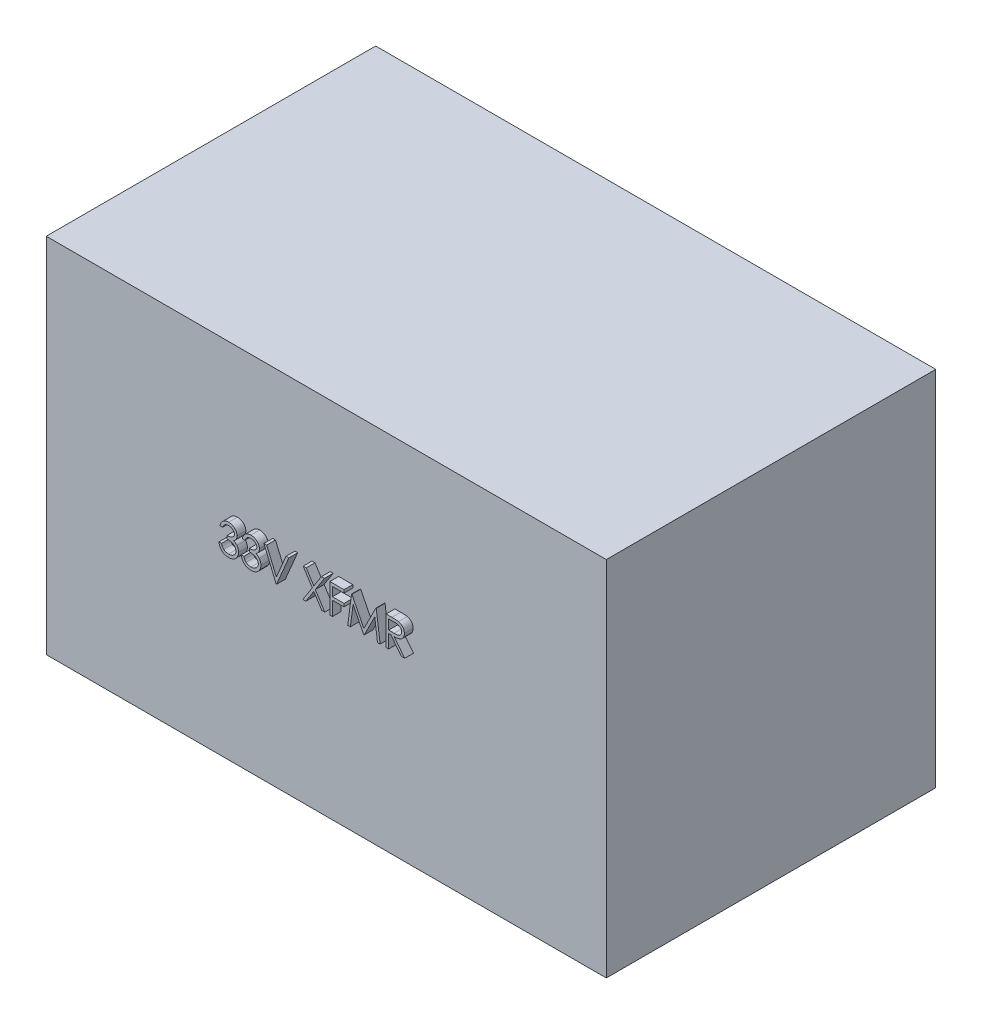
from build123d import *

# Parameters (mm, degrees)
SKETCH1_W           = 102
SKETCH1_H           = 60
BOSS_EXTRUDE1_DEPTH = 66
BOSS_EXTRUDE2_DEPTH = 1.6


with BuildPart() as part:
    # Sketch1 → Boss-Extrude1 (new body)
    with BuildSketch(Plane(origin=(0, 0, 0), x_dir=(1, 0, 0), z_dir=(0, 1, 0))):
        Rectangle(SKETCH1_W, SKETCH1_H)
    extrude(amount=BOSS_EXTRUDE1_DEPTH)

    # Sketch2 → Boss-Extrude2 (add)
    # profile 1 of 7: a face of its own
    with BuildSketch(Plane.XY.offset(30)):
        with BuildLine():
            Line((-17.291654312, 37.742865683), (-17.766547475, 37.742865683))
            add(Edge.make_bspline(
                [(-17.766547475, 37.742865683), (-17.753681845, 37.796133843), (-17.72853059, 37.90026874), (-17.676071163, 38.049051146), (-17.618922289, 38.189845041), (-17.550298286, 38.320014105), (-17.475445765, 38.442174351), (-17.389686412, 38.553555051), (-17.296976831, 38.656988939), (-17.194431968, 38.748781572), (-17.086892205, 38.831902663), (-16.972842245, 38.902773285), (-16.854576679, 38.963739564), (-16.731276109, 39.013965391), (-16.602573445, 39.051801599), (-16.469632229, 39.07925296), (-16.33210408, 39.097080002), (-16.238747603, 39.098819846), (-16.191343816, 39.09970329)],
                knots=[0, 0, 0, 0, 1.162005537, 2.271625781, 3.343758855, 4.383309926, 5.390229558, 6.379919256, 7.361854164, 8.333198761, 9.295911338, 10.242430842, 11.177959212, 12.116337295, 13.062827104, 14.020064771, 14.994644689, 16, 16, 16, 16], degree=3))
            add(Edge.make_bspline(
                [(-16.191343816, 39.09970329), (-16.12227586, 39.097618025), (-15.985646522, 39.093492981), (-15.784921439, 39.055824726), (-15.591357082, 38.996217681), (-15.407072148, 38.913858593), (-15.23589666, 38.812277775), (-15.08359314, 38.691378708), (-14.952225987, 38.55349405), (-14.84201663, 38.401196006), (-14.755724667, 38.238431129), (-14.692094079, 38.070911844), (-14.653356537, 37.89903553), (-14.648336172, 37.782985834), (-14.645820979, 37.724845184)],
                knots=[0, 0, 0, 0, 1.083050992, 2.142477498, 3.193116406, 4.255571735, 5.30263384, 6.308962982, 7.297363603, 8.282367274, 9.249857812, 10.179914175, 11.08814088, 12, 12, 12, 12], degree=3))
            add(Edge.make_bspline(
                [(-14.645820979, 37.724845184), (-14.647580218, 37.668894434), (-14.651022775, 37.559407501), (-14.680253497, 37.399566666), (-14.729445228, 37.248918056), (-14.797586416, 37.106827489), (-14.885793284, 36.974195886), (-14.992643671, 36.850724837), (-15.118891743, 36.735866705), (-15.214563471, 36.670069407), (-15.263818108, 36.63619501)],
                knots=[0, 0, 0, 0, 1.024540389, 2.004866551, 2.965041327, 3.920577974, 4.882998113, 5.874504559, 6.905732034, 8, 8, 8, 8], degree=3))
            add(Edge.make_bspline(
                [(-15.263818108, 36.63619501), (-15.207527241, 36.609013727), (-15.095998752, 36.555159743), (-14.943975928, 36.449544491), (-14.805972473, 36.327599775), (-14.729010898, 36.232436479), (-14.690342213, 36.184622494)],
                knots=[0, 0, 0, 0, 1.015518401, 2.012035669, 3.001164323, 4, 4, 4, 4], degree=3))
            add(Edge.make_bspline(
                [(-14.690342213, 36.184622494), (-14.664879707, 36.14976137), (-14.614371662, 36.080609996), (-14.552027462, 35.969429923), (-14.495468444, 35.857017552), (-14.451396089, 35.740359879), (-14.417266552, 35.620809013), (-14.392870408, 35.498159676), (-14.377714862, 35.372311714), (-14.375544444, 35.287172607), (-14.374453458, 35.244376434)],
                knots=[0, 0, 0, 0, 1.025084078, 2.033381695, 3.024893161, 4.013698104, 4.991890475, 5.976764909, 6.982997093, 8, 8, 8, 8], degree=3))
            add(Edge.make_bspline(
                [(-14.374453458, 35.244376434), (-14.377166591, 35.170278403), (-14.38258009, 35.022431048), (-14.430967203, 34.803999028), (-14.505977697, 34.590479519), (-14.612501874, 34.386259226), (-14.74232537, 34.195184126), (-14.896777515, 34.024223516), (-15.074103394, 33.877268483), (-15.271869078, 33.754486353), (-15.486131879, 33.656336637), (-15.715299738, 33.588214075), (-15.956070653, 33.543845718), (-16.121181686, 33.539087952), (-16.205124198, 33.536669102)],
                knots=[0, 0, 0, 0, 0.955779014, 1.907060117, 2.875433937, 3.871313158, 4.872415639, 5.851225146, 6.836215519, 7.83643374, 8.849228613, 9.86973379, 10.916971861, 12, 12, 12, 12], degree=3))
            add(Edge.make_bspline(
                [(-16.205124198, 33.536669102), (-16.261698616, 33.537981758), (-16.373018206, 33.540564626), (-16.536672066, 33.558221559), (-16.692884636, 33.590470496), (-16.841867123, 33.63386716), (-16.98375188, 33.688888008), (-17.118105944, 33.757405563), (-17.245755902, 33.838007477), (-17.365497173, 33.931645163), (-17.477315484, 34.036391951), (-17.578239246, 34.154107359), (-17.669951076, 34.282615339), (-17.749995303, 34.423408531), (-17.822017839, 34.574667432), (-17.881255714, 34.738328852), (-17.933394609, 34.912929694), (-17.95763568, 35.034604373), (-17.970073116, 35.09703235)],
                knots=[0, 0, 0, 0, 1.048658725, 2.063410685, 3.046034179, 4.001477787, 4.936774919, 5.862367409, 6.792675028, 7.730719943, 8.675894397, 9.627829632, 10.600096036, 11.597688215, 12.626045268, 13.701542398, 14.82072376, 16, 16, 16, 16], degree=3))
            Line((-17.970073116, 35.09703235), (-17.495179953, 35.09703235))
            add(Edge.make_bspline(
                [(-17.495179953, 35.09703235), (-17.482807596, 35.056288008), (-17.458742287, 34.977036725), (-17.417778288, 34.862978168), (-17.371108401, 34.758417778), (-17.321042342, 34.662588534), (-17.268460644, 34.574546687), (-17.209624983, 34.49662029), (-17.148893061, 34.425386591), (-17.103113563, 34.385253666), (-17.080708466, 34.365612077)],
                knots=[0, 0, 0, 0, 1.198163088, 2.33053128, 3.407730985, 4.417276592, 5.372219308, 6.28897303, 7.162600585, 8, 8, 8, 8], degree=3))
            add(Edge.make_bspline(
                [(-17.080708466, 34.365612077), (-17.051080308, 34.342769715), (-16.991915449, 34.297155501), (-16.895503957, 34.238944705), (-16.794108236, 34.188506012), (-16.685531288, 34.149977091), (-16.5721161, 34.117353723), (-16.452029488, 34.096004843), (-16.32633091, 34.081357251), (-16.240503458, 34.080064676), (-16.196643963, 34.079404145)],
                knots=[0, 0, 0, 0, 0.946170439, 1.889420265, 2.845303464, 3.807233317, 4.801018734, 5.828864929, 6.890507805, 8, 8, 8, 8], degree=3))
            add(Edge.make_bspline(
                [(-16.196643963, 34.079404145), (-16.147123786, 34.080335335), (-16.050291355, 34.082156197), (-15.908996509, 34.09890161), (-15.774576915, 34.123289259), (-15.648524992, 34.160955317), (-15.529189582, 34.207493033), (-15.418243516, 34.265925741), (-15.314230356, 34.334482641), (-15.218482326, 34.412404941), (-15.132386142, 34.497708868), (-15.056579973, 34.586931011), (-14.992135545, 34.679695182), (-14.940150849, 34.776514722), (-14.899101803, 34.876988699), (-14.871156964, 34.981399072), (-14.851726697, 35.088891367), (-14.850144319, 35.161960165), (-14.84934662, 35.19879517)],
                knots=[0, 0, 0, 0, 1.217147791, 2.380027433, 3.494444702, 4.572153297, 5.609568379, 6.639424714, 7.649109417, 8.668170816, 9.669597737, 10.625200337, 11.543417969, 12.441394052, 13.322311151, 14.205496177, 15.095365482, 16, 16, 16, 16], degree=3))
            add(Edge.make_bspline(
                [(-14.84934662, 35.19879517), (-14.85166029, 35.248100409), (-14.856276118, 35.34646555), (-14.89151647, 35.491181406), (-14.949481182, 35.630614423), (-15.030628907, 35.762385677), (-15.129410306, 35.884511147), (-15.244866773, 35.993476364), (-15.37795707, 36.083389478), (-15.500451396, 36.145511614), (-15.608953478, 36.187901001), (-15.70180769, 36.216135769), (-15.805761126, 36.24004451), (-15.919556678, 36.262288063), (-16.044051779, 36.281219149), (-16.179110893, 36.29700618), (-16.32476139, 36.309638206), (-16.425592081, 36.315279267), (-16.477551748, 36.318186196)],
                knots=[0, 0, 0, 0, 1.07054697, 2.135767047, 3.216561865, 4.33974944, 5.486079747, 6.621378074, 7.775625952, 8.963672916, 9.598146892, 10.304877434, 11.070270905, 11.915000392, 12.823868403, 13.805723172, 14.86925407, 16, 16, 16, 16], degree=3))
            Line((-16.477551748, 36.318186196), (-16.477551748, 36.860921239))
            add(Edge.make_bspline(
                [(-16.477551748, 36.860921239), (-16.41208451, 36.862032192), (-16.283850271, 36.864208276), (-16.096533882, 36.89052753), (-15.917413517, 36.926935146), (-15.7504588, 36.982702044), (-15.598287531, 37.047472493), (-15.466268609, 37.122844286), (-15.356251613, 37.206626109), (-15.268771183, 37.300111126), (-15.202959135, 37.400373162), (-15.154840048, 37.504870966), (-15.126415746, 37.614520439), (-15.122621368, 37.689351663), (-15.120714141, 37.726965242)],
                knots=[0, 0, 0, 0, 1.321986639, 2.589447074, 3.816329219, 5.01088745, 6.139805852, 7.153945165, 8.075214402, 8.924034688, 9.728124013, 10.488707548, 11.240355623, 12, 12, 12, 12], degree=3))
            add(Edge.make_bspline(
                [(-15.120714141, 37.726965242), (-15.121340691, 37.754599452), (-15.122587183, 37.809576402), (-15.138306876, 37.889896447), (-15.161928938, 37.967760972), (-15.194404243, 38.042838852), (-15.237871806, 38.114609385), (-15.289890381, 38.183684457), (-15.351830247, 38.249669694), (-15.422807291, 38.311174463), (-15.499025139, 38.369789857), (-15.582557537, 38.419552142), (-15.670885848, 38.462104795), (-15.764107862, 38.497195352), (-15.862526104, 38.523592133), (-15.965678162, 38.542545131), (-16.073760731, 38.554394918), (-16.147498945, 38.556100976), (-16.184983639, 38.556968247)],
                knots=[0, 0, 0, 0, 0.884392785, 1.759457502, 2.611959086, 3.489218968, 4.37281399, 5.2945488, 6.255912374, 7.266815255, 8.301784654, 9.332968512, 10.37626691, 11.440494194, 12.520033166, 13.637162961, 14.798855837, 16, 16, 16, 16], degree=3))
            add(Edge.make_bspline(
                [(-16.184983639, 38.556968247), (-16.245235566, 38.55486464), (-16.362921592, 38.550755807), (-16.532579859, 38.514767918), (-16.690300757, 38.457348672), (-16.810858027, 38.388809464), (-16.899882871, 38.32115107), (-16.963499194, 38.262062224), (-17.025971871, 38.196395931), (-17.08319093, 38.120107673), (-17.141057538, 38.038363836), (-17.193739196, 37.947008984), (-17.244931826, 37.84842615), (-17.275778538, 37.77873394), (-17.291654312, 37.742865683)],
                knots=[0, 0, 0, 0, 1.472543308, 2.876219568, 4.221790263, 5.565193594, 6.249813518, 6.953379497, 7.687249741, 8.463570142, 9.283606569, 10.136032583, 11.040678096, 12, 12, 12, 12], degree=3))
        make_face()
    # profile 2 of 7: a face of its own
    with BuildSketch(Plane.XY.offset(30)):
        with BuildLine():
            Line((-13.221141492, 37.742865683), (-13.696034654, 37.742865683))
            add(Edge.make_bspline(
                [(-13.696034654, 37.742865683), (-13.683169024, 37.796133843), (-13.658017769, 37.90026874), (-13.605558343, 38.049051146), (-13.548409469, 38.189845041), (-13.479785466, 38.320014105), (-13.404932944, 38.442174351), (-13.319173591, 38.553555051), (-13.226464011, 38.656988939), (-13.123919147, 38.748781572), (-13.016379385, 38.831902663), (-12.902329424, 38.902773285), (-12.784063859, 38.963739564), (-12.660763289, 39.013965391), (-12.532060624, 39.051801599), (-12.399119408, 39.07925296), (-12.261591259, 39.097080002), (-12.168234783, 39.098819846), (-12.120830995, 39.09970329)],
                knots=[0, 0, 0, 0, 1.162005537, 2.271625781, 3.343758855, 4.383309926, 5.390229558, 6.379919256, 7.361854164, 8.333198761, 9.295911338, 10.242430842, 11.177959212, 12.116337295, 13.062827104, 14.020064771, 14.994644689, 16, 16, 16, 16], degree=3))
            add(Edge.make_bspline(
                [(-12.120830995, 39.09970329), (-12.05176304, 39.097618025), (-11.915133702, 39.093492981), (-11.714408619, 39.055824726), (-11.520844261, 38.996217681), (-11.336559327, 38.913858593), (-11.16538384, 38.812277775), (-11.013080319, 38.691378708), (-10.881713166, 38.55349405), (-10.77150381, 38.401196006), (-10.685211847, 38.238431129), (-10.621581258, 38.070911844), (-10.582843717, 37.89903553), (-10.577823351, 37.782985834), (-10.575308159, 37.724845184)],
                knots=[0, 0, 0, 0, 1.083050992, 2.142477498, 3.193116406, 4.255571735, 5.30263384, 6.308962982, 7.297363603, 8.282367274, 9.249857812, 10.179914175, 11.08814088, 12, 12, 12, 12], degree=3))
            add(Edge.make_bspline(
                [(-10.575308159, 37.724845184), (-10.577067397, 37.668894434), (-10.580509955, 37.559407501), (-10.609740676, 37.399566666), (-10.658932407, 37.248918056), (-10.727073596, 37.106827489), (-10.815280463, 36.974195886), (-10.92213085, 36.850724837), (-11.048378922, 36.735866705), (-11.14405065, 36.670069407), (-11.193305287, 36.63619501)],
                knots=[0, 0, 0, 0, 1.024540389, 2.004866551, 2.965041327, 3.920577974, 4.882998113, 5.874504559, 6.905732034, 8, 8, 8, 8], degree=3))
            add(Edge.make_bspline(
                [(-11.193305287, 36.63619501), (-11.13701442, 36.609013727), (-11.025485932, 36.555159743), (-10.873463107, 36.449544491), (-10.735459653, 36.327599775), (-10.658498078, 36.232436479), (-10.619829393, 36.184622494)],
                knots=[0, 0, 0, 0, 1.015518401, 2.012035669, 3.001164323, 4, 4, 4, 4], degree=3))
            add(Edge.make_bspline(
                [(-10.619829393, 36.184622494), (-10.594366887, 36.14976137), (-10.543858842, 36.080609996), (-10.481514642, 35.969429923), (-10.424955624, 35.857017552), (-10.380883268, 35.740359879), (-10.346753732, 35.620809013), (-10.322357588, 35.498159676), (-10.307202041, 35.372311714), (-10.305031623, 35.287172607), (-10.303940637, 35.244376434)],
                knots=[0, 0, 0, 0, 1.025084078, 2.033381695, 3.024893161, 4.013698104, 4.991890475, 5.976764909, 6.982997093, 8, 8, 8, 8], degree=3))
            add(Edge.make_bspline(
                [(-10.303940637, 35.244376434), (-10.306653771, 35.170278403), (-10.31206727, 35.022431048), (-10.360454382, 34.803999028), (-10.435464877, 34.590479519), (-10.541989054, 34.386259226), (-10.671812549, 34.195184126), (-10.826264694, 34.024223516), (-11.003590574, 33.877268483), (-11.201356257, 33.754486353), (-11.415619058, 33.656336637), (-11.644786918, 33.588214075), (-11.885557833, 33.543845718), (-12.050668866, 33.539087952), (-12.134611377, 33.536669102)],
                knots=[0, 0, 0, 0, 0.955779014, 1.907060117, 2.875433937, 3.871313158, 4.872415639, 5.851225146, 6.836215519, 7.83643374, 8.849228613, 9.86973379, 10.916971861, 12, 12, 12, 12], degree=3))
            add(Edge.make_bspline(
                [(-12.134611377, 33.536669102), (-12.191185795, 33.537981758), (-12.302505385, 33.540564626), (-12.466159246, 33.558221559), (-12.622371815, 33.590470496), (-12.771354302, 33.63386716), (-12.91323906, 33.688888008), (-13.047593123, 33.757405563), (-13.175243082, 33.838007477), (-13.294984353, 33.931645163), (-13.406802664, 34.036391951), (-13.507726425, 34.154107359), (-13.599438255, 34.282615339), (-13.679482483, 34.423408531), (-13.751505018, 34.574667432), (-13.810742893, 34.738328852), (-13.862881789, 34.912929694), (-13.887122859, 35.034604373), (-13.899560295, 35.09703235)],
                knots=[0, 0, 0, 0, 1.048658725, 2.063410685, 3.046034179, 4.001477787, 4.936774919, 5.862367409, 6.792675028, 7.730719943, 8.675894397, 9.627829632, 10.600096036, 11.597688215, 12.626045268, 13.701542398, 14.82072376, 16, 16, 16, 16], degree=3))
            Line((-13.899560295, 35.09703235), (-13.424667133, 35.09703235))
            add(Edge.make_bspline(
                [(-13.424667133, 35.09703235), (-13.412294776, 35.056288008), (-13.388229466, 34.977036725), (-13.347265468, 34.862978168), (-13.30059558, 34.758417778), (-13.250529521, 34.662588534), (-13.197947823, 34.574546687), (-13.139112163, 34.49662029), (-13.078380241, 34.425386591), (-13.032600742, 34.385253666), (-13.010195645, 34.365612077)],
                knots=[0, 0, 0, 0, 1.198163088, 2.33053128, 3.407730985, 4.417276592, 5.372219308, 6.28897303, 7.162600585, 8, 8, 8, 8], degree=3))
            add(Edge.make_bspline(
                [(-13.010195645, 34.365612077), (-12.980567488, 34.342769715), (-12.921402628, 34.297155501), (-12.824991136, 34.238944705), (-12.723595416, 34.188506012), (-12.615018468, 34.149977091), (-12.501603279, 34.117353723), (-12.381516667, 34.096004843), (-12.255818089, 34.081357251), (-12.169990637, 34.080064676), (-12.126131142, 34.079404145)],
                knots=[0, 0, 0, 0, 0.946170439, 1.889420265, 2.845303464, 3.807233317, 4.801018734, 5.828864929, 6.890507805, 8, 8, 8, 8], degree=3))
            add(Edge.make_bspline(
                [(-12.126131142, 34.079404145), (-12.076610965, 34.080335335), (-11.979778535, 34.082156197), (-11.838483688, 34.09890161), (-11.704064095, 34.123289259), (-11.578012171, 34.160955317), (-11.458676761, 34.207493033), (-11.347730696, 34.265925741), (-11.243717535, 34.334482641), (-11.147969506, 34.412404941), (-11.061873322, 34.497708868), (-10.986067153, 34.586931011), (-10.921622724, 34.679695182), (-10.869638029, 34.776514722), (-10.828588982, 34.876988699), (-10.800644143, 34.981399072), (-10.781213876, 35.088891367), (-10.779631498, 35.161960165), (-10.7788338, 35.19879517)],
                knots=[0, 0, 0, 0, 1.217147791, 2.380027433, 3.494444702, 4.572153297, 5.609568379, 6.639424714, 7.649109417, 8.668170816, 9.669597737, 10.625200337, 11.543417969, 12.441394052, 13.322311151, 14.205496177, 15.095365482, 16, 16, 16, 16], degree=3))
            add(Edge.make_bspline(
                [(-10.7788338, 35.19879517), (-10.78114747, 35.248100409), (-10.785763298, 35.34646555), (-10.82100365, 35.491181406), (-10.878968361, 35.630614423), (-10.960116087, 35.762385677), (-11.058897486, 35.884511147), (-11.174353952, 35.993476364), (-11.30744425, 36.083389478), (-11.429938576, 36.145511614), (-11.538440658, 36.187901001), (-11.63129487, 36.216135769), (-11.735248306, 36.24004451), (-11.849043857, 36.262288063), (-11.973538958, 36.281219149), (-12.108598073, 36.29700618), (-12.254248569, 36.309638206), (-12.355079261, 36.315279267), (-12.407038928, 36.318186196)],
                knots=[0, 0, 0, 0, 1.07054697, 2.135767047, 3.216561865, 4.33974944, 5.486079747, 6.621378074, 7.775625952, 8.963672916, 9.598146892, 10.304877434, 11.070270905, 11.915000392, 12.823868403, 13.805723172, 14.86925407, 16, 16, 16, 16], degree=3))
            Line((-12.407038928, 36.318186196), (-12.407038928, 36.860921239))
            add(Edge.make_bspline(
                [(-12.407038928, 36.860921239), (-12.341571689, 36.862032192), (-12.213337451, 36.864208276), (-12.026021062, 36.89052753), (-11.846900697, 36.926935146), (-11.67994598, 36.982702044), (-11.527774711, 37.047472493), (-11.395755789, 37.122844286), (-11.285738792, 37.206626109), (-11.198258363, 37.300111126), (-11.132446314, 37.400373162), (-11.084327228, 37.504870966), (-11.055902925, 37.614520439), (-11.052108548, 37.689351663), (-11.050201321, 37.726965242)],
                knots=[0, 0, 0, 0, 1.321986639, 2.589447074, 3.816329219, 5.01088745, 6.139805852, 7.153945165, 8.075214402, 8.924034688, 9.728124013, 10.488707548, 11.240355623, 12, 12, 12, 12], degree=3))
            add(Edge.make_bspline(
                [(-11.050201321, 37.726965242), (-11.050827871, 37.754599452), (-11.052074362, 37.809576402), (-11.067794056, 37.889896447), (-11.091416118, 37.967760972), (-11.123891423, 38.042838852), (-11.167358985, 38.114609385), (-11.21937756, 38.183684457), (-11.281317426, 38.249669694), (-11.352294471, 38.311174463), (-11.428512319, 38.369789857), (-11.512044717, 38.419552142), (-11.600373027, 38.462104795), (-11.693595041, 38.497195352), (-11.792013284, 38.523592133), (-11.895165341, 38.542545131), (-12.00324791, 38.554394918), (-12.076986124, 38.556100976), (-12.114470819, 38.556968247)],
                knots=[0, 0, 0, 0, 0.884392785, 1.759457502, 2.611959086, 3.489218968, 4.37281399, 5.2945488, 6.255912374, 7.266815255, 8.301784654, 9.332968512, 10.37626691, 11.440494194, 12.520033166, 13.637162961, 14.798855837, 16, 16, 16, 16], degree=3))
            add(Edge.make_bspline(
                [(-12.114470819, 38.556968247), (-12.174722745, 38.55486464), (-12.292408772, 38.550755807), (-12.462067039, 38.514767918), (-12.619787937, 38.457348672), (-12.740345206, 38.388809464), (-12.829370051, 38.32115107), (-12.892986374, 38.262062224), (-12.95545905, 38.196395931), (-13.012678109, 38.120107673), (-13.070544717, 38.038363836), (-13.123226376, 37.947008984), (-13.174419005, 37.84842615), (-13.205265717, 37.77873394), (-13.221141492, 37.742865683)],
                knots=[0, 0, 0, 0, 1.472543308, 2.876219568, 4.221790263, 5.565193594, 6.249813518, 6.953379497, 7.687249741, 8.463570142, 9.283606569, 10.136032583, 11.040678096, 12, 12, 12, 12], degree=3))
        make_face()
    # profile 3 of 7: a face of its own
    with BuildSketch(Plane.XY.offset(30)):
        Polygon((-9.761205594, 38.964019529), (-9.252391492, 38.964019529), (-7.488502603, 34.793863947), (-5.724613714, 38.964019529), (-5.215799612, 38.964019529), (-7.454581663, 33.672352863), (-7.522423543, 33.672352863), align=None)
    # profile 4 of 7: a face of its own
    with BuildSketch(Plane.XY.offset(30)):
        Polygon((-2.603887218, 38.964019529), (-2.055852029, 38.964019529), (-0.670393629, 36.799439535), (0.715064771, 38.964019529), (1.263099961, 38.964019529), (-0.395846019, 36.371187665), (1.330941841, 33.672352863), (0.782906652, 33.672352863), (-0.670393629, 35.942935795), (-2.123693909, 33.672352863), (-2.671729099, 33.672352863), (-0.943881209, 36.371187665), align=None)
    # profile 5 of 7: a face of its own
    with BuildSketch(Plane.XY.offset(30)):
        Polygon((2.246807226, 38.964019529), (4.824798679, 38.964019529), (4.824798679, 38.421284486), (2.721700388, 38.421284486), (2.721700388, 36.793079358), (4.824798679, 36.793079358), (4.824798679, 36.250344316), (2.721700388, 36.250344316), (2.721700388, 33.672352863), (2.246807226, 33.672352863), align=None)
    # profile 6 of 7: a face of its own
    with BuildSketch(Plane.XY.offset(30)):
        Polygon((5.503217482, 33.672352863), (6.201776844, 38.964019529), (6.269618724, 38.964019529), (8.454339277, 34.622139187), (10.633759683, 38.964019529), (10.702661593, 38.964019529), (11.405461072, 33.672352863), (10.928447851, 33.672352863), (10.421753807, 37.479978397), (8.511580864, 33.672352863), (8.404517896, 33.672352863), (6.486924747, 37.488458632), (5.981290733, 33.672352863), align=None)
    # profile 7 of 7: a face of its own
    with BuildSketch(Plane.XY.offset(30)):
        with BuildLine():
            Line((12.490931158, 38.964019529), (13.549900509, 38.964019529))
            add(Edge.make_bspline(
                [(13.549900509, 38.964019529), (13.620568643, 38.963784298), (13.75625929, 38.963332628), (13.95064983, 38.960814153), (14.127281274, 38.953595782), (14.286061269, 38.947383995), (14.426986903, 38.936056893), (14.550490306, 38.925230677), (14.656002659, 38.911058595), (14.719874362, 38.897896824), (14.748793738, 38.891937531)],
                knots=[0, 0, 0, 0, 1.410062039, 2.707475311, 3.878576406, 4.937260626, 5.877586885, 6.699081471, 7.410979367, 8, 8, 8, 8], degree=3))
            add(Edge.make_bspline(
                [(14.748793738, 38.891937531), (14.787508515, 38.882372065), (14.864112177, 38.863445189), (14.97440573, 38.823440792), (15.079504767, 38.777146836), (15.178972716, 38.722773116), (15.272311352, 38.659916009), (15.360483084, 38.589660633), (15.443888011, 38.512391405), (15.519153095, 38.426160157), (15.59012047, 38.335693053), (15.649974703, 38.237867135), (15.701570691, 38.135569349), (15.742649925, 38.027759325), (15.775727337, 37.915482598), (15.799050342, 37.797722155), (15.813037256, 37.675014491), (15.814461252, 37.591318605), (15.815183294, 37.548880306)],
                knots=[0, 0, 0, 0, 1.027469482, 2.033020251, 3.019912614, 3.986113645, 4.951240523, 5.91722682, 6.890402269, 7.87763091, 8.8651537, 9.85103654, 10.82876324, 11.815024772, 12.821070561, 13.842952187, 14.906261191, 16, 16, 16, 16], degree=3))
            add(Edge.make_bspline(
                [(15.815183294, 37.548880306), (15.812962309, 37.47837247), (15.808628592, 37.340793418), (15.76822278, 37.141129943), (15.702036852, 36.954879431), (15.610833784, 36.782276396), (15.494690053, 36.626685301), (15.355103761, 36.490023541), (15.191997039, 36.375663197), (15.040157478, 36.296359552), (14.906030057, 36.245570273), (14.795610644, 36.20983435), (14.675161761, 36.182223997), (14.545837458, 36.157489036), (14.40709955, 36.138814451), (14.259280562, 36.125136861), (14.102275071, 36.116588478), (13.994417192, 36.115315447), (13.938931291, 36.114660555)],
                knots=[0, 0, 0, 0, 1.260483769, 2.459530307, 3.627416485, 4.787058657, 5.939039949, 7.08810263, 8.267026773, 9.491475466, 10.141966685, 10.831826277, 11.566392101, 12.351337768, 13.187381173, 14.07005841, 15.007169909, 16, 16, 16, 16], degree=3))
            Line((13.938931291, 36.114660555), (15.883025175, 33.672352863))
            Line((15.883025175, 33.672352863), (15.295768898, 33.672352863))
            Line((15.295768898, 33.672352863), (13.351675015, 36.114660555))
            Line((13.351675015, 36.114660555), (12.96582432, 36.114660555))
            Line((12.96582432, 36.114660555), (12.96582432, 33.672352863))
            Line((12.96582432, 33.672352863), (12.490931158, 33.672352863))
            Line((12.490931158, 33.672352863), (12.490931158, 38.964019529))
        make_face()
        with BuildLine():
            Line((12.96582432, 38.421284486), (12.96582432, 36.657395598))
            Line((12.96582432, 36.657395598), (13.934691174, 36.649975392))
            add(Edge.make_bspline(
                [(13.934691174, 36.649975392), (13.979927423, 36.649955379), (14.067608158, 36.649916589), (14.194457973, 36.655954799), (14.312568142, 36.662823863), (14.421486898, 36.673330612), (14.521262899, 36.686871339), (14.611846274, 36.703809184), (14.693384888, 36.72354266), (14.788481487, 36.754085594), (14.894672434, 36.802475646), (15.010078331, 36.872878245), (15.108355675, 36.961429175), (15.191386253, 37.062686662), (15.25810575, 37.174017658), (15.305144214, 37.294087644), (15.334992906, 37.419865418), (15.338513445, 37.506313271), (15.340290132, 37.549940336)],
                knots=[0, 0, 0, 0, 1.146690395, 2.22261258, 3.21895312, 4.145990853, 4.996080663, 5.770904154, 6.481378293, 7.121626537, 8.300444488, 9.431385265, 10.535395872, 11.636531494, 12.74115979, 13.810798291, 14.895190096, 16, 16, 16, 16], degree=3))
            add(Edge.make_bspline(
                [(15.340290132, 37.549940336), (15.338472639, 37.592495275), (15.334871032, 37.676823636), (15.305466347, 37.800279595), (15.255740734, 37.916797484), (15.188729732, 38.025903313), (15.107088152, 38.124941747), (15.01135765, 38.209679704), (14.904155747, 38.27960449), (14.803960007, 38.324287899), (14.714403519, 38.351683391), (14.636646771, 38.370961936), (14.548787751, 38.386450598), (14.450399856, 38.398860404), (14.341903104, 38.409526808), (14.222748906, 38.416711045), (14.093727821, 38.420965339), (14.004303294, 38.421175628), (13.95801182, 38.421284486)],
                knots=[0, 0, 0, 0, 1.101028733, 2.181837193, 3.264309656, 4.369019818, 5.486613113, 6.575447106, 7.666700264, 8.788928104, 9.402425223, 10.0903467, 10.862060571, 11.710948788, 12.657782767, 13.684531032, 14.801375019, 16, 16, 16, 16], degree=3))
            Line((13.95801182, 38.421284486), (12.96582432, 38.421284486))
        make_face(mode=Mode.SUBTRACT)
    extrude(amount=BOSS_EXTRUDE2_DEPTH)


solid = part.part
